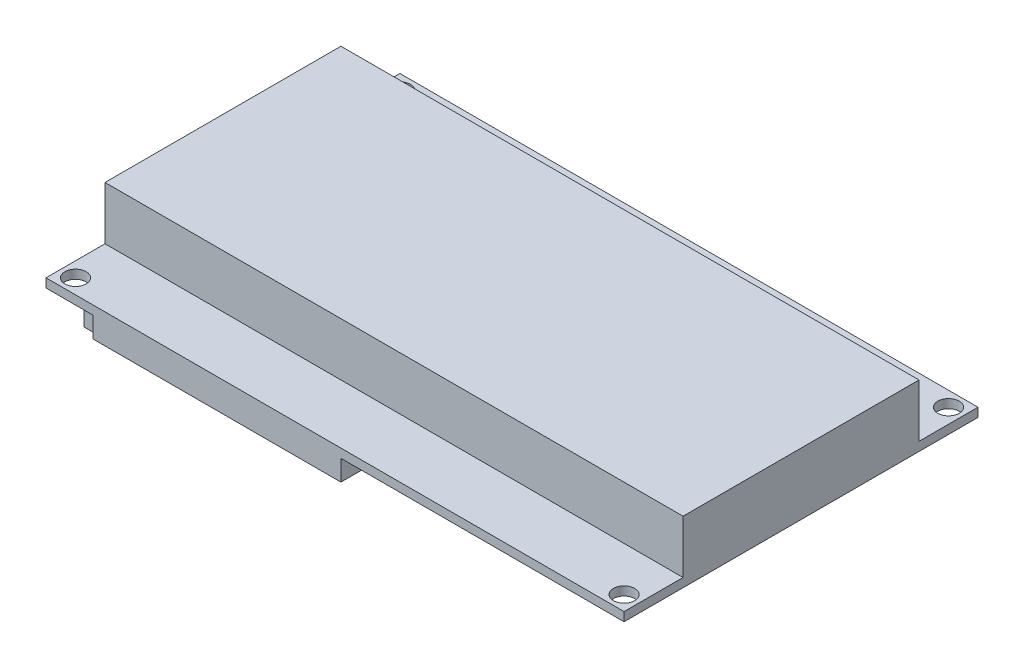
from build123d import *

# Parameters (mm, degrees)
SKIZZE1_W                            = 49
SKIZZE1_H                            = 30
AUFSATZ_LINEAR_AUSTRAGEN1_DEPTH      = 1.5
SKIZZE2_W                            = 49
SKIZZE2_H                            = 20
AUFSATZ_LINEAR_AUSTRAGEN2_DEPTH      = 9
SCHNITT_LINEAR_AUSTRAGEN1_DEPTH      = 59.154965394
SCHNITT_LINEAR_AUSTRAGEN1_DEPTH_BACK = 59.154965394
SKIZZE3_R                            = 1.8
SKIZZE4_W                            = 42
SKIZZE4_H                            = 20.4
AUFSATZ_LINEAR_AUSTRAGEN3_DEPTH      = 3.5
SKIZZE5_W                            = 9.3
SKIZZE5_H                            = 10
SKIZZE5_W_2                          = 5.202111929
SKIZZE5_H_2                          = 5.340958118
SKIZZE5_W_3                          = 5.892281305
SKIZZE5_H_3                          = 9.90280044
SKIZZE5_H_4                          = 4.8
AUFSATZ_LINEAR_AUSTRAGEN4_DEPTH      = 4.2


with BuildPart() as part:
    # Skizze1 → Aufsatz-Linear austragen1 (new body)
    with BuildSketch(Plane(origin=(0, 0, 0), x_dir=(1, 0, 0), z_dir=(0, 1, 0))):
        with Locations((-24.5, -15)):
            Rectangle(SKIZZE1_W, SKIZZE1_H)
    extrude(amount=AUFSATZ_LINEAR_AUSTRAGEN1_DEPTH)

    # Skizze2 → Aufsatz-Linear austragen2 (add)
    with BuildSketch(Plane(origin=(0, 1.5, 0), x_dir=(1, 0, 0), z_dir=(0, 1, 0))):
        with Locations((-24.5, -10)):
            Rectangle(SKIZZE2_W, SKIZZE2_H)
    extrude(amount=AUFSATZ_LINEAR_AUSTRAGEN2_DEPTH)

    # Skizze3 → Schnitt-Linear austragen1 (cut, two sides: drawn at the far end of the back side and taken through both)
    with BuildSketch(Plane(origin=(0, 1.5, 0), x_dir=(1, 0, 0), z_dir=(0, 1, 0)).offset(-SCHNITT_LINEAR_AUSTRAGEN1_DEPTH_BACK)):
        with Locations(Location((-46.5, -27.5, 0), (0, 0, 270))):
            Circle(SKIZZE3_R)
    extrude(amount=SCHNITT_LINEAR_AUSTRAGEN1_DEPTH + SCHNITT_LINEAR_AUSTRAGEN1_DEPTH_BACK, mode=Mode.SUBTRACT)

    # Spiegeln1: part across plane


with BuildPart() as part_1:
    add(part.part)
    add(part.part.mirror(Plane(origin=(0, 1.5, 0), x_dir=(0, 0, 1), z_dir=(-1, 0, 0))))

    # Spiegeln2: part across plane


with BuildPart() as part_2:
    add(part_1.part)
    add(part_1.part.mirror(Plane(origin=(0, 1.5, 0), x_dir=(1, 0, 0), z_dir=(0, 0, 1))))

    # Skizze4 → Aufsatz-Linear austragen3 (add)
    with BuildSketch(Plane.XZ):
        with Locations((-20, 19.8)):
            Rectangle(SKIZZE4_W, SKIZZE4_H)
    extrude(amount=AUFSATZ_LINEAR_AUSTRAGEN3_DEPTH)

    # Skizze5 → Aufsatz-Linear austragen4 (add)
    with BuildSketch(Plane.XZ.offset(3.5)):
        with Locations((-43.15, 19.8)):
            Rectangle(SKIZZE5_W, SKIZZE5_H)
        with Locations((-28.561234427, 15.050145035)):
            Rectangle(SKIZZE5_W_2, SKIZZE5_H_2)
        with Locations((-17.866219882, 19.8)):
            Rectangle(SKIZZE5_W_3, SKIZZE5_H_3)
        with Locations((3.15, 17.4)):
            Rectangle(SKIZZE5_W, SKIZZE5_H_4)
    extrude(amount=AUFSATZ_LINEAR_AUSTRAGEN4_DEPTH)


solid = part_2.part
